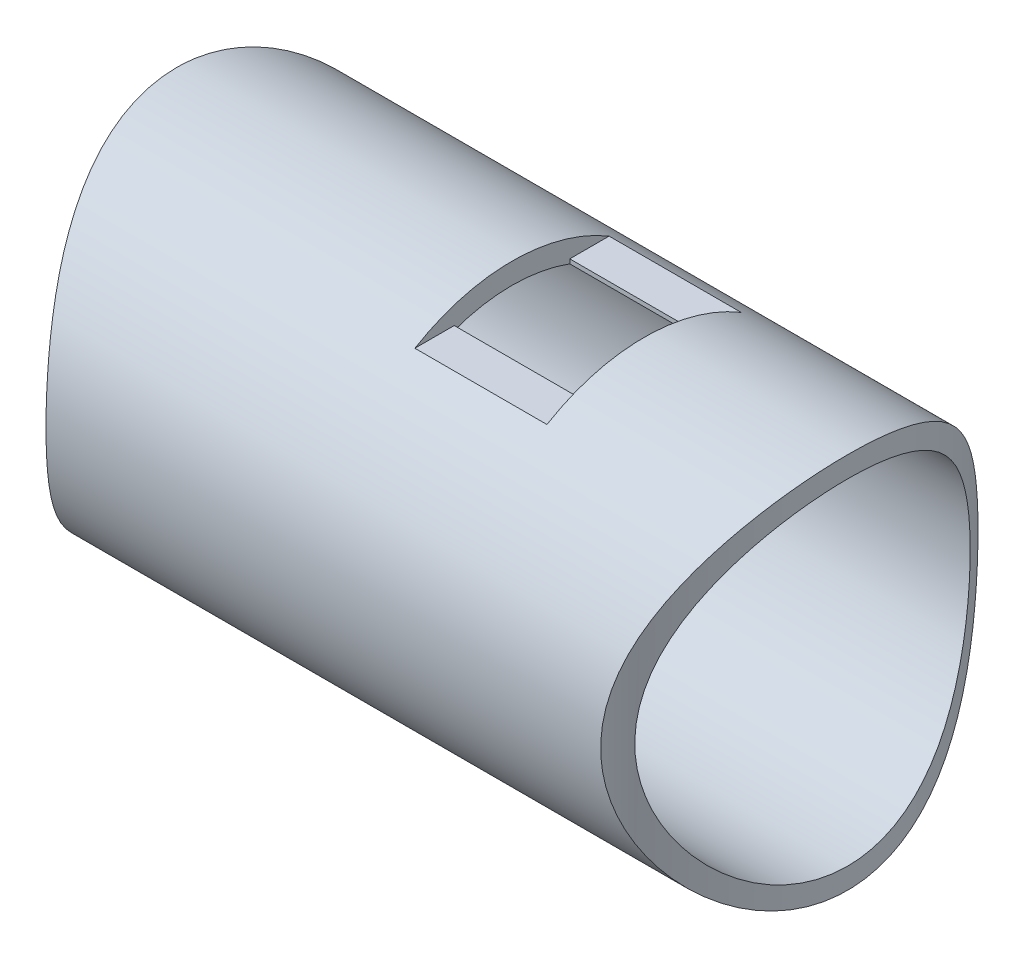
from build123d import *

# Parameters (mm, degrees)
BOSS_EXTRUDE1_DEPTH      = 101.6
BOSS_EXTRUDE1_DEPTH_BACK = 101.6
SKETCH1_R                = 57.15
SKETCH1_R_2              = 50.8
CUT_EXTRUDE3_DEPTH       = 130.826056707
CUT_EXTRUDE3_DEPTH_BACK  = 130.826056707
SKETCH3_W                = 40
SKETCH3_H                = 10
SKETCH5_W                = 40
SKETCH5_H                = 35
CUT_EXTRUDE5_DEPTH       = 18.15
CUT_EXTRUDE6_DEPTH       = 130.826056707
CUT_EXTRUDE6_DEPTH_BACK  = 130.826056707
SKETCH6_W                = 252.16572489
SKETCH6_H                = 244.887597008
SKETCH6_R                = 101.6


with BuildPart() as part:
    # Sketch1 → Boss-Extrude1 (new, two sides: drawn at the far end of the back side and taken through both)
    with BuildSketch(Plane(origin=(0, 0, 0), x_dir=(0, 0, -1), z_dir=(1, 0, 0)).offset(-BOSS_EXTRUDE1_DEPTH_BACK)):
        Circle(SKETCH1_R)
        Circle(SKETCH1_R_2, mode=Mode.SUBTRACT)
    extrude(amount=BOSS_EXTRUDE1_DEPTH + BOSS_EXTRUDE1_DEPTH_BACK)

    # Sketch3 → Cut-Extrude3 (cut, two sides: drawn at the far end of the back side and taken through both)
    with BuildSketch(Plane.XY.offset(-CUT_EXTRUDE3_DEPTH_BACK)):
        with Locations((20, 54)):
            Rectangle(SKETCH3_W, SKETCH3_H)
    extrude(amount=CUT_EXTRUDE3_DEPTH + CUT_EXTRUDE3_DEPTH_BACK, mode=Mode.SUBTRACT)

    # Sketch5 → Cut-Extrude5 (cut)
    with BuildSketch(Plane(origin=(0, 49, 0), x_dir=(1, 0, 0), z_dir=(0, 1, 0))):
        with Locations((20, 0)):
            Rectangle(SKETCH5_W, SKETCH5_H)
    extrude(amount=-CUT_EXTRUDE5_DEPTH, mode=Mode.SUBTRACT)

    # Sketch6 → Cut-Extrude6 (cut, two sides: drawn at the far end of the back side and taken through both)
    with BuildSketch(Plane(origin=(0, 0, 0), x_dir=(1, 0, 0), z_dir=(0, 1, 0)).offset(-CUT_EXTRUDE6_DEPTH_BACK)):
        Rectangle(SKETCH6_W, SKETCH6_H)
        Circle(SKETCH6_R, mode=Mode.SUBTRACT)
    extrude(amount=CUT_EXTRUDE6_DEPTH + CUT_EXTRUDE6_DEPTH_BACK, mode=Mode.SUBTRACT)


solid = part.part
